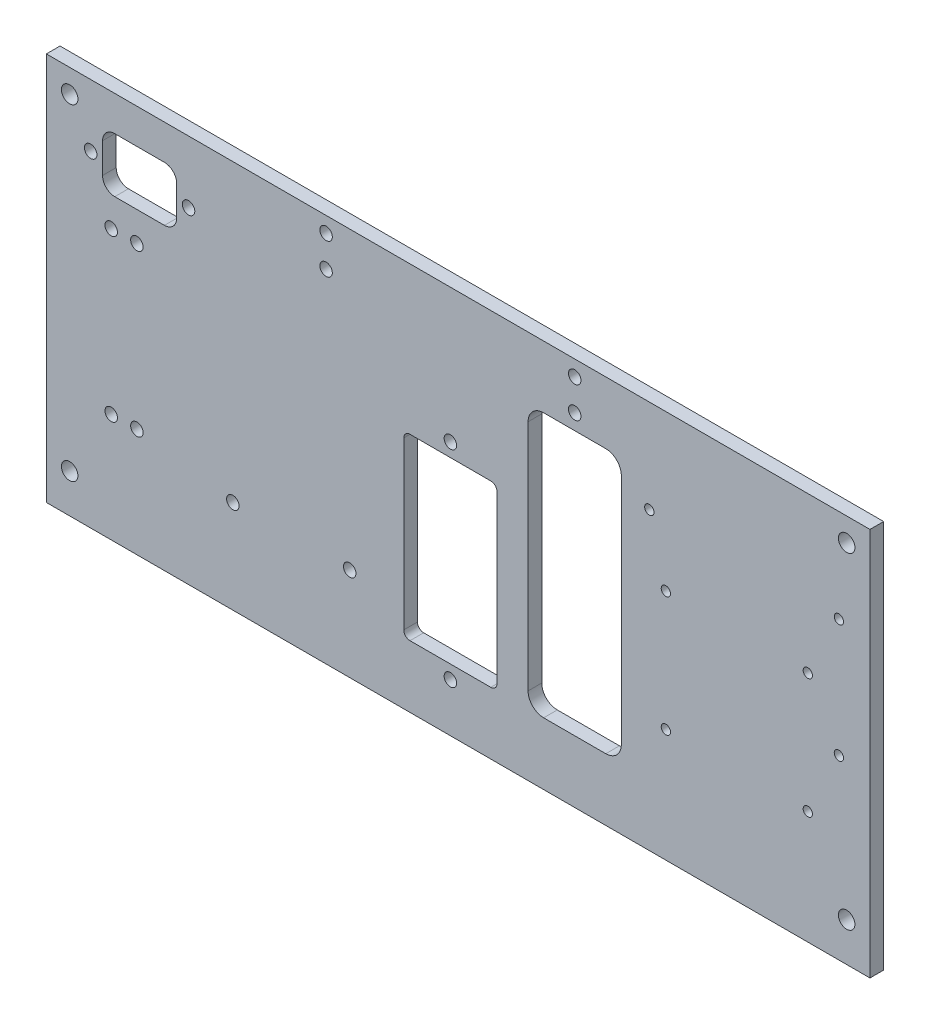
from build123d import *

# Parameters (mm, degrees)
SKETCH1_W               = 336.55
SKETCH1_H               = 158.75
BOSS_EXTRUDE1_DEPTH     = 5.588
F_1_4_CLEARANCE_HOLE1_D = 6.7564
F_6_CLEARANCE_HOLE1_D   = 3.7973
F_6_CLEARANCE_HOLE2_D   = 3.7973
CUT_EXTRUDE1_REACH      = 188.14
F_10_CLEARANCE_HOLE1_D  = 5.1054
CUT_EXTRUDE2_REACH      = 188.14
F_10_CLEARANCE_HOLE3_D  = 5.1054
F_10_CLEARANCE_HOLE2_D  = 5.1054
F_10_CLEARANCE_HOLE4_D  = 5.1054
CUT_EXTRUDE3_REACH      = 188.14
SKETCH24_R              = 2.5527


with BuildPart() as part:
    # Sketch1 → Boss-Extrude1 (new body)
    with BuildSketch(Plane.XY):
        Rectangle(SKETCH1_W, SKETCH1_H)
    extrude(amount=BOSS_EXTRUDE1_DEPTH)

    # 1/4 Clearance Hole1 (through all)
    with Locations(Plane(origin=(0, 0, 0), x_dir=(-1, 0, 0), z_dir=(0, 0, -1))):
        with Locations((-158.75, 69.85), (158.75, -63.5), (-158.75, -63.5), (158.75, 69.85)):
            Hole(F_1_4_CLEARANCE_HOLE1_D / 2)

    # #6 Clearance Hole1 (through all)
    with Locations(Plane(origin=(0, 0, 0), x_dir=(-1, 0, 0), z_dir=(0, 0, -1))):
        with Locations((-155.575, 41.275), (-155.575, -6.985), (-78.105, 41.275)):
            Hole(F_6_CLEARANCE_HOLE1_D / 2)

    # #6 Clearance Hole2 (through all)
    with Locations(Plane(origin=(0, 0, 0), x_dir=(-1, 0, 0), z_dir=(0, 0, -1))):
        with Locations((-142.875, 15.875), (-84.875, -33.125), (-142.875, -33.125), (-84.875, 15.875)):
            Hole(F_6_CLEARANCE_HOLE2_D / 2)

    # Sketch11 → Cut-Extrude1 (cut, up to next)
    with BuildSketch(Plane(origin=(0, 0, 0), x_dir=(-1, 0, 0), z_dir=(0, 0, -1)), mode=Mode.PRIVATE) as cut_extrude1_sk1:
        with BuildLine():
            Line((-13.335, 19.05), (19.685, 19.05))
            ThreePointArc((19.685, 19.05), (21.481051224, 18.306051224), (22.225, 16.51))
            Line((22.225, 16.51), (22.225, -51.435))
            ThreePointArc((22.225, -51.435), (21.481051224, -53.231051224), (19.685, -53.975))
            Line((19.685, -53.975), (-13.335, -53.975))
            ThreePointArc((-13.335, -53.975), (-15.131051224, -53.231051224), (-15.875, -51.435))
            Line((-15.875, -51.435), (-15.875, 16.51))
            ThreePointArc((-15.875, 16.51), (-15.131051224, 18.306051224), (-13.335, 19.05))
        make_face()
    cut_extrude1_tool1 = extrude(cut_extrude1_sk1.sketch, amount=-CUT_EXTRUDE1_REACH, mode=Mode.PRIVATE) & part.part
    add(cut_extrude1_tool1.solids().sort_by_distance((-3.175, -17.4625, 0))[0], mode=Mode.SUBTRACT)

    # #10 Clearance Hole1 (through all)
    with Locations(Plane(origin=(0, 0, 0), x_dir=(-1, 0, 0), z_dir=(0, 0, -1))):
        with Locations((3.175, 24.60625), (3.175, -59.53125)):
            Hole(F_10_CLEARANCE_HOLE1_D / 2)

    # Sketch15 → Cut-Extrude2 (cut, up to next)
    with BuildSketch(Plane(origin=(0, 0, 0), x_dir=(-1, 0, 0), z_dir=(0, 0, -1)), mode=Mode.PRIVATE) as cut_extrude2_sk1:
        with BuildLine():
            Line((-60.325, 53.975), (-34.925, 53.975))
            ThreePointArc((-34.925, 53.975), (-30.434871939, 52.115128061), (-28.575, 47.625))
            Line((-28.575, 47.625), (-28.575, -47.625))
            ThreePointArc((-28.575, -47.625), (-30.434871939, -52.115128061), (-34.925, -53.975))
            Line((-34.925, -53.975), (-60.325, -53.975))
            ThreePointArc((-60.325, -53.975), (-64.815128061, -52.115128061), (-66.675, -47.625))
            Line((-66.675, -47.625), (-66.675, 47.625))
            ThreePointArc((-66.675, 47.625), (-64.815128061, 52.115128061), (-60.325, 53.975))
        make_face()
    cut_extrude2_tool1 = extrude(cut_extrude2_sk1.sketch, amount=-CUT_EXTRUDE2_REACH, mode=Mode.PRIVATE) & part.part
    add(cut_extrude2_tool1.solids().sort_by_distance((47.625, 0, 0))[0], mode=Mode.SUBTRACT)

    # #10 Clearance Hole3 (through all)
    with Locations(Plane(origin=(0, 0, 0), x_dir=(-1, 0, 0), z_dir=(0, 0, -1))):
        with Locations((131.2799, 30.7848), (131.2799, -34.925), (141.7701, 30.7848), (141.7701, -34.925)):
            Hole(F_10_CLEARANCE_HOLE3_D / 2)

    # #10 Clearance Hole2 (through all)
    with Locations(Plane(origin=(0, 0, 0), x_dir=(-1, 0, 0), z_dir=(0, 0, -1))):
        with Locations((-47.625, 73.025), (53.975, 60.325), (-47.625, 60.325), (53.975, 73.025)):
            Hole(F_10_CLEARANCE_HOLE2_D / 2)

    # #10 Clearance Hole4 (through all)
    with Locations(Plane(origin=(0, 0, 0), x_dir=(-1, 0, 0), z_dir=(0, 0, -1))):
        with Locations((44.323, -41.275), (92.075, -41.275)):
            Hole(F_10_CLEARANCE_HOLE4_D / 2)

    # Sketch24 → Cut-Extrude3 (cut, up to next)
    with BuildSketch(Plane(origin=(0, 0, 0), x_dir=(-1, 0, 0), z_dir=(0, 0, -1)), mode=Mode.PRIVATE) as cut_extrude3_sk1:
        with Locations((110.175, 53.975)):
            Circle(SKETCH24_R)
    cut_extrude3_tool1 = extrude(cut_extrude3_sk1.sketch, amount=-CUT_EXTRUDE3_REACH, mode=Mode.PRIVATE) & part.part
    # Sketch24 → Cut-Extrude3 (cut, up to next)
    with BuildSketch(Plane(origin=(0, 0, 0), x_dir=(-1, 0, 0), z_dir=(0, 0, -1)), mode=Mode.PRIVATE) as cut_extrude3_sk2:
        with Locations((150.175, 53.975)):
            Circle(SKETCH24_R)
    cut_extrude3_tool2 = extrude(cut_extrude3_sk2.sketch, amount=-CUT_EXTRUDE3_REACH, mode=Mode.PRIVATE) & part.part
    # Sketch24 → Cut-Extrude3 (cut, up to next)
    with BuildSketch(Plane(origin=(0, 0, 0), x_dir=(-1, 0, 0), z_dir=(0, 0, -1)), mode=Mode.PRIVATE) as cut_extrude3_sk3:
        with BuildLine():
            Line((120.025, 65.125), (140.325, 65.125))
            ThreePointArc((140.325, 65.125), (143.860533906, 63.660533906), (145.325, 60.125))
            Line((145.325, 60.125), (145.325, 47.825))
            ThreePointArc((145.325, 47.825), (143.860533906, 44.289466094), (140.325, 42.825))
            Line((140.325, 42.825), (120.025, 42.825))
            ThreePointArc((120.025, 42.825), (116.489466094, 44.289466094), (115.025, 47.825))
            Line((115.025, 47.825), (115.025, 60.125))
            ThreePointArc((115.025, 60.125), (116.489466094, 63.660533906), (120.025, 65.125))
        make_face()
    cut_extrude3_tool3 = extrude(cut_extrude3_sk3.sketch, amount=-CUT_EXTRUDE3_REACH, mode=Mode.PRIVATE) & part.part
    add(cut_extrude3_tool1.solids().sort_by_distance((-110.175, 53.975, 0))[0], mode=Mode.SUBTRACT)
    add(cut_extrude3_tool2.solids().sort_by_distance((-150.175, 53.975, 0))[0], mode=Mode.SUBTRACT)
    add(cut_extrude3_tool3.solids().sort_by_distance((-130.175, 53.975, 0))[0], mode=Mode.SUBTRACT)


solid = part.part
